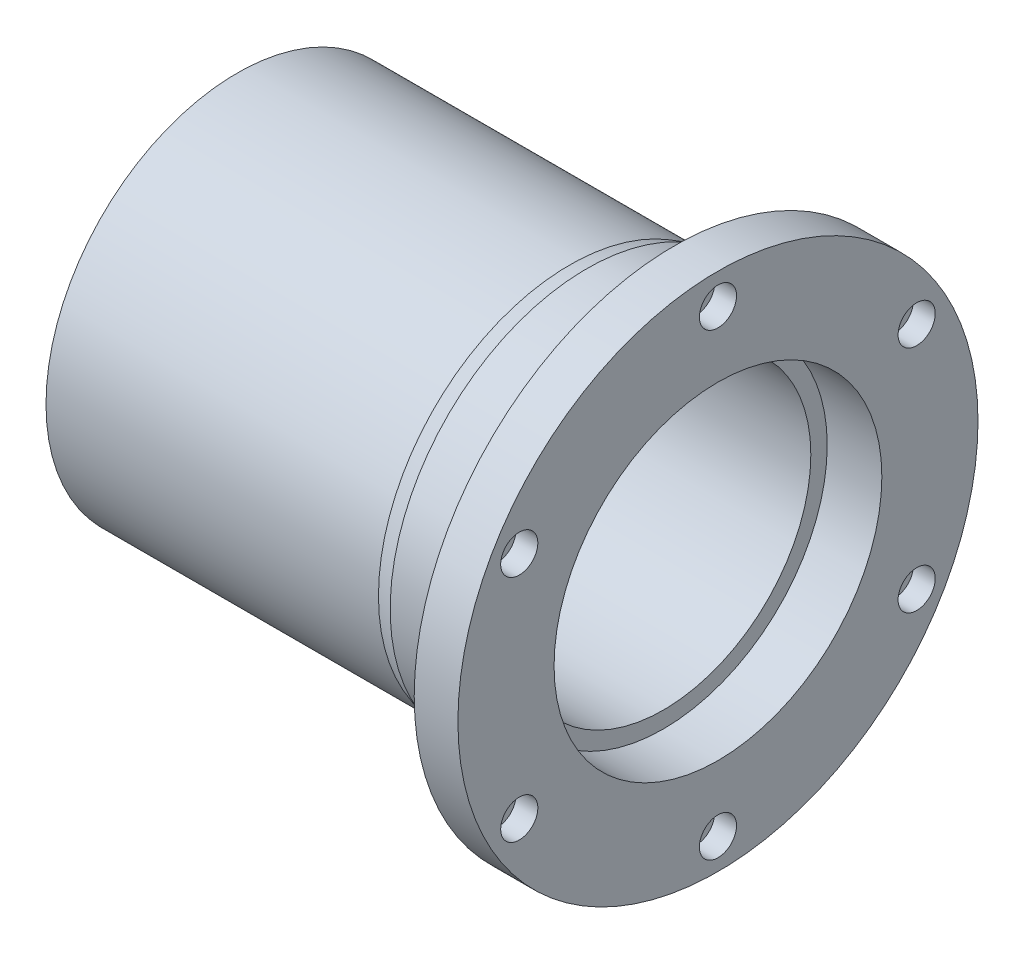
from build123d import *

# Parameters (mm, degrees)
SCHIZZO12_R                 = 5
TAGLIO_ESTRUSIONE1_DEPTH    = 20
SCHIZZO13_R                 = 8.5
TAGLIO_ESTRUSIONE2_DEPTH    = 10
RIPETIZIONECIRCOLARE1_COUNT = 6


with BuildPart() as part:
    # Schizzo1 → Rivoluzione1 (revolve)
    with BuildSketch(Plane.XY, mode=Mode.PRIVATE) as rivoluzione1_sk:
        Polygon((-83.213348426, 75), (-108.213348426, 75), (-108.213348426, 87.5), (43.926418272, 87.5), (51.786651574, 90), (91.786651574, 90), (91.786651574, 119), (111.786651574, 119), (111.786651574, 75), (86.786651574, 75), (86.786651574, 67.5), (-83.213348426, 67.5), align=None)
    revolve(rivoluzione1_sk.sketch.rotate(Axis((0, 0, 0), (-1, 0, 0)), 90), axis=Axis((0, 0, 0), (-1, 0, 0)))

    # Schizzo12 → Taglio-Estrusione1 (cut)
    with BuildSketch(Plane(origin=(111.786651574, 0, 0), x_dir=(0, 0, -1), z_dir=(1, 0, 0))):
        with Locations((0, -105)):
            Circle(SCHIZZO12_R)
    taglio_estrusione1 = extrude(amount=-TAGLIO_ESTRUSIONE1_DEPTH, mode=Mode.SUBTRACT)

    # Schizzo13 → Taglio-Estrusione2 (cut)
    with BuildSketch(Plane(origin=(111.786651574, 0, 0), x_dir=(0, 0, -1), z_dir=(1, 0, 0))):
        with Locations((0, -105)):
            Circle(SCHIZZO13_R)
    taglio_estrusione2 = extrude(amount=-TAGLIO_ESTRUSIONE2_DEPTH, mode=Mode.SUBTRACT)

    # RipetizioneCircolare1: Taglio-Estrusione1, Taglio-Estrusione2 ×6 about axis
    ripetizionecircolare1_axis = Axis((0, 0, 0), (1, 0, 0))
    add([taglio_estrusione1.rotate(ripetizionecircolare1_axis, i * 360 / RIPETIZIONECIRCOLARE1_COUNT) for i in range(1, RIPETIZIONECIRCOLARE1_COUNT)], mode=Mode.SUBTRACT)
    add([taglio_estrusione2.rotate(ripetizionecircolare1_axis, i * 360 / RIPETIZIONECIRCOLARE1_COUNT) for i in range(1, RIPETIZIONECIRCOLARE1_COUNT)], mode=Mode.SUBTRACT)


solid = part.part
